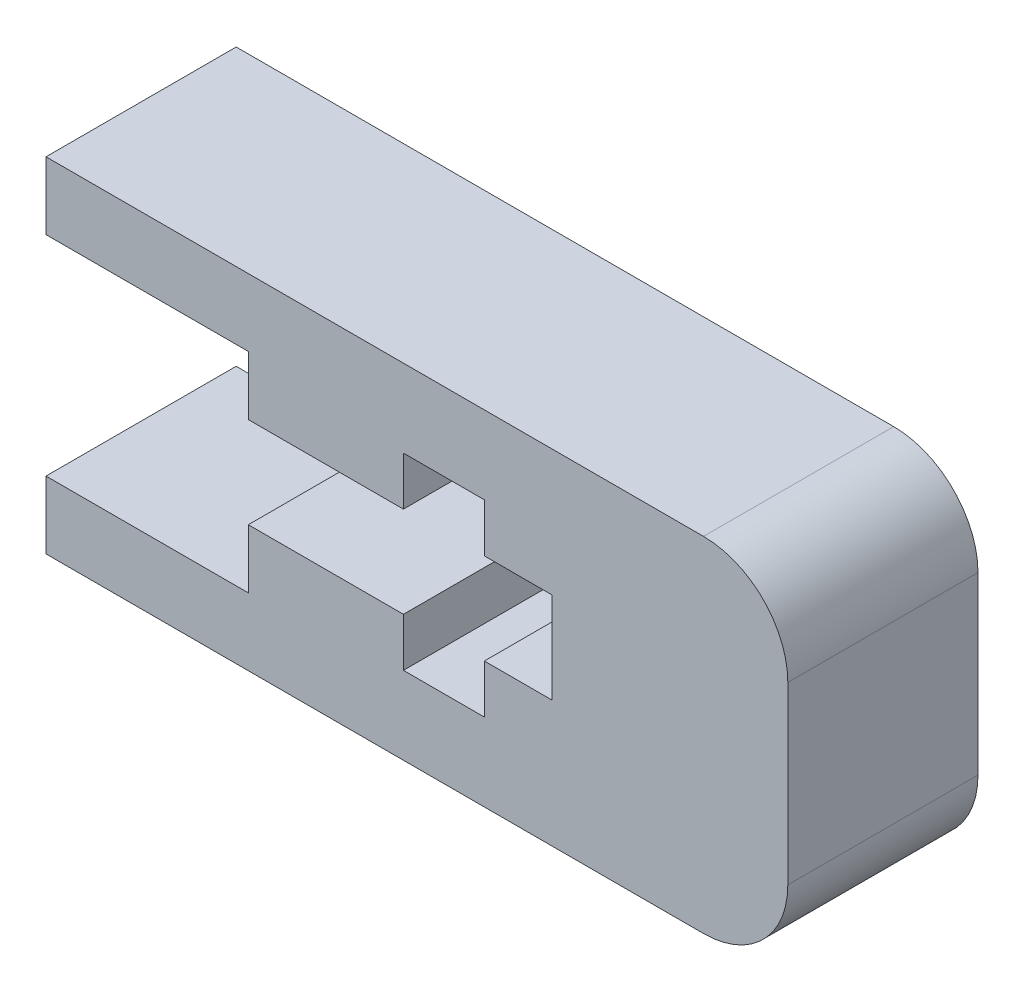
from build123d import *

# Parameters (mm, degrees)
BOSS_EXTRUDE2_DEPTH = 5.64
FILLET1_R           = 2.5


with BuildPart() as part:
    # Sketch1 → Boss-Extrude2 (new body)
    with BuildSketch(Plane.XY):
        Polygon((727.33944815, 350.756300382), (749.33944815, 350.756300382), (749.33944815, 340.556300382), (727.33944815, 340.556300382), (727.33944815, 342.556300382), (733.33944815, 342.556300382), (733.33944815, 344.306300382), (737.93944815, 344.306300382), (737.93944815, 342.866300382), (740.33944815, 342.866300382), (740.33944815, 344.306300382), (742.33944815, 344.306300382), (742.33944815, 347.006300382), (740.33944815, 347.006300382), (740.33944815, 348.446300382), (737.93944815, 348.446300382), (737.93944815, 347.006300382), (733.33944815, 347.006300382), (733.33944815, 348.756300382), (727.33944815, 348.756300382), align=None)
    extrude(amount=BOSS_EXTRUDE2_DEPTH)

    # Fillet1
    fillet1_edges = [part.edges().sort_by_distance(p)[0] for p in [
        (749.33944815, 350.756300382, 2.82),
        (749.33944815, 340.556300382, 2.82),
    ]]
    fillet(fillet1_edges, radius=FILLET1_R)


solid = part.part
